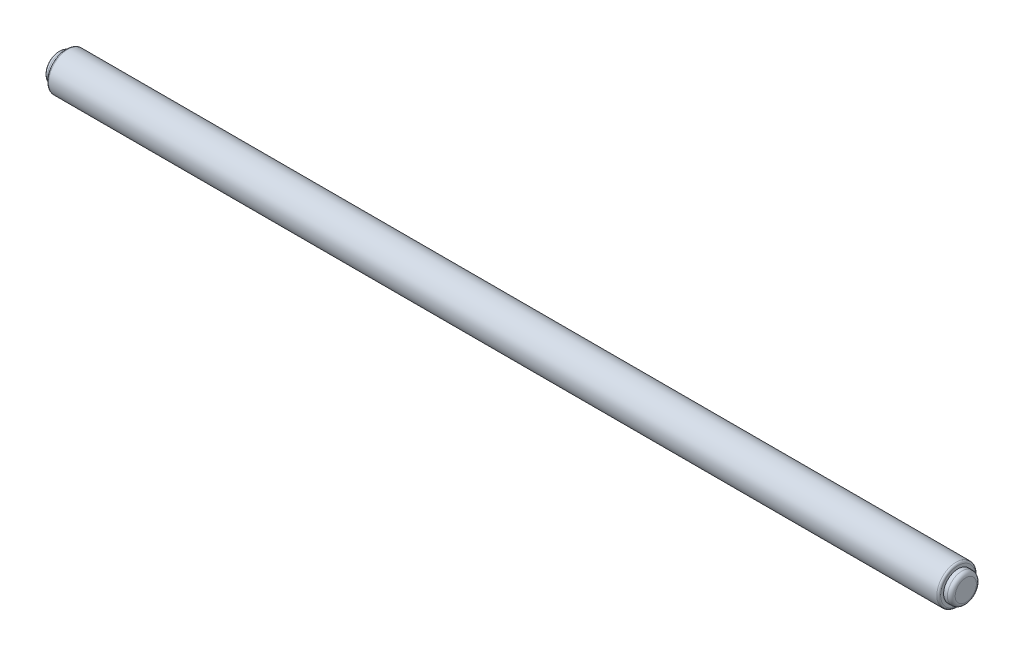
from build123d import *

# Parameters (mm, degrees)
RADYUS1_R = 1
RADYUS2_R = 2


with BuildPart() as part:
    # Çizim1 → Döndür1 (revolve)
    with BuildSketch(Plane.XY, mode=Mode.PRIVATE) as d_nd_r1_sk:
        Polygon((-235, 0), (-235, 7.5), (-231, 7.5), (-231, 10), (231, 10), (231, 7.5), (235, 7.5), (235, 0), align=None)
    revolve(d_nd_r1_sk.sketch.rotate(Axis((-235, 0, 0), (1, 0, 0)), 180), axis=Axis((-235, 0, 0), (1, 0, 0)))

    # Radyus1
    radyus1_edges = [part.edges().sort_by_distance(p)[0] for p in [
        (231, 10, 0),
        (-231, 10, 0),
    ]]
    fillet(radyus1_edges, radius=RADYUS1_R)

    # Radyus2
    radyus2_edges = [part.edges().sort_by_distance(p)[0] for p in [
        (235, 7.5, 0),
        (-235, 7.5, 0),
    ]]
    fillet(radyus2_edges, radius=RADYUS2_R)


solid = part.part
